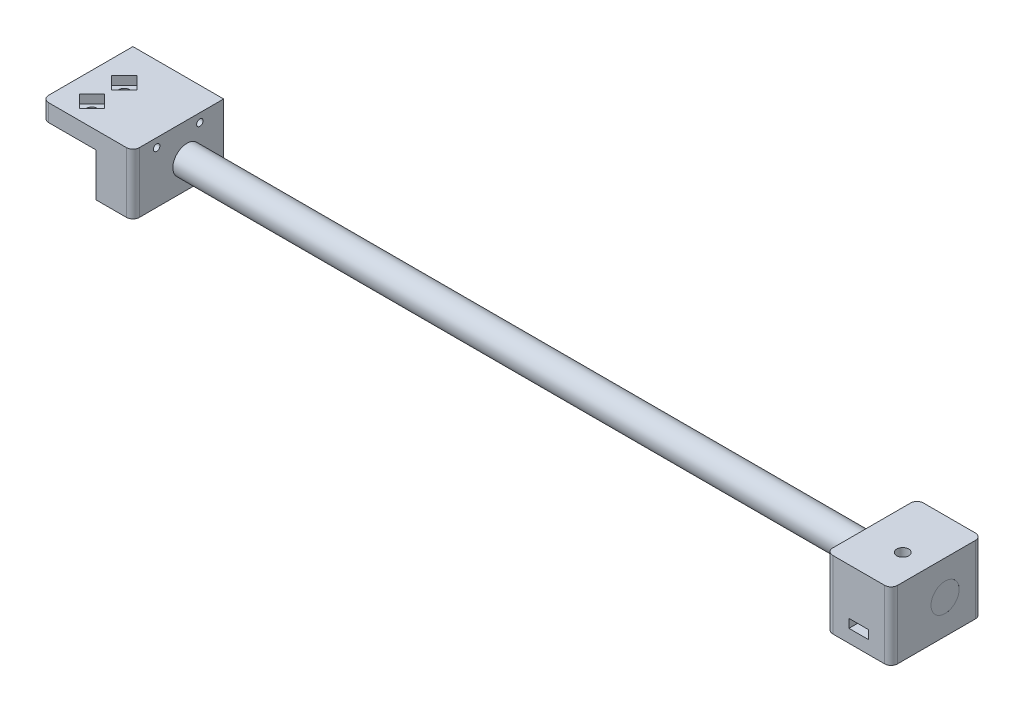
from build123d import *

# Parameters (mm, degrees)
SKETCH2_W                = 42
SKETCH2_H                = 42
BOSS_EXTRUDE1_DEPTH      = 22
SKETCH3_W                = 42
SKETCH3_H                = 42
BOSS_EXTRUDE2_DEPTH      = 6
BOSS_EXTRUDE3_START      = -25
SKETCH4_R                = 6.5
BOSS_EXTRUDE3_DEPTH      = 368
CUT_EXTRUDE6_START       = -25
SKETCH4_3_R              = 6.5
CUT_EXTRUDE6_DEPTH       = 17
SKETCH8_W                = 42
SKETCH8_H                = 28
SKETCH8_R                = 6.5
BOSS_EXTRUDE5_DEPTH      = 30
SKETCH11_W               = 25
SKETCH11_H               = 20
CUT_EXTRUDE9_DEPTH       = 50
SKETCH10_R               = 2.75
CUT_EXTRUDE8_DEPTH       = 12
FILLET2_R                = 3
FILLET1_R                = 3
SKETCH12_R               = 2.5
CUT_EXTRUDE10_DEPTH      = 20
CUT_EXTRUDE11_DEPTH      = 4
SKETCH14_R               = 2.5
CUT_EXTRUDE12_DEPTH      = 10
SKETCH15_R               = 1.5
CUT_EXTRUDE13_DEPTH      = 20
SKETCH16_R               = 2.5
BOSS_EXTRUDE6_DEPTH      = 3.5
CUT_EXTRUDE14_START      = -6
SKETCH18_W               = 9
SKETCH18_H               = 9
CUT_EXTRUDE14_DEPTH      = 4
SKETCH19_W               = 9
SKETCH19_H               = 9
CUT_EXTRUDE15_DEPTH      = 7
CUT_EXTRUDE16_DEPTH      = 7
CUT_EXTRUDE16_DEPTH_BACK = 4
SKETCH20_W               = 9
SKETCH20_H               = 9


with BuildPart() as part:
    # Sketch2 → Boss-Extrude1 (new body)
    with BuildSketch(Plane(origin=(0, 0, 0), x_dir=(1, 0, 0), z_dir=(0, 1, 0))):
        with Locations((21, -21)):
            Rectangle(SKETCH2_W, SKETCH2_H)
    extrude(amount=-BOSS_EXTRUDE1_DEPTH)

    # Sketch3 → Boss-Extrude2 (add)
    with BuildSketch(Plane(origin=(0, 0, 0), x_dir=(1, 0, 0), z_dir=(0, 1, 0))):
        with Locations((21, -21)):
            Rectangle(SKETCH3_W, SKETCH3_H)
    extrude(amount=BOSS_EXTRUDE2_DEPTH)

    # Sketch4<3> → Cut-Extrude6 (cut)
    with BuildSketch(Plane.ZY.offset(CUT_EXTRUDE6_START)):
        with Locations((17, -9.8)):
            Circle(SKETCH4_3_R)
    extrude(amount=-CUT_EXTRUDE6_DEPTH, mode=Mode.SUBTRACT)

    # Sketch11 → Cut-Extrude9 (cut)
    with BuildSketch(Plane.XY.offset(42)):
        with Locations((12.5, -12)):
            Rectangle(SKETCH11_W, SKETCH11_H)
    extrude(amount=-CUT_EXTRUDE9_DEPTH, mode=Mode.SUBTRACT)

    # Fillet1
    fillet1_edges = [part.edges().sort_by_distance(p)[0] for p in [
        (0, 2, 42),
        (42, -8, 42),
    ]]
    fillet(fillet1_edges, radius=FILLET1_R)

    # Sketch12 → Cut-Extrude10 (cut)
    with BuildSketch(Plane.XZ.offset(2)):
        with Locations(Location((12.5, 31.5, 0), (0, 0, 270))):
            Circle(SKETCH12_R)
        with Locations(Location((12.5, 16.5, 0), (0, 0, 270))):
            Circle(SKETCH12_R)
    extrude(amount=-CUT_EXTRUDE10_DEPTH, mode=Mode.SUBTRACT)

    # Sketch13 → Cut-Extrude11 (cut)
    with BuildSketch(Plane(origin=(0, 6, 0), x_dir=(1, 0, 0), z_dir=(0, 1, 0))):
        Polygon((6.701724394, -31.5), (12.5, -37.298275606), (18.298275606, -31.5), (12.5, -25.701724394), align=None)
        Polygon((6.701724394, -16.5), (12.5, -22.298275606), (18.298275606, -16.5), (12.5, -10.701724394), align=None)
    extrude(amount=-CUT_EXTRUDE11_DEPTH, mode=Mode.SUBTRACT)

    # Sketch15 → Cut-Extrude13 (cut)
    with BuildSketch(Plane(origin=(42, 0, 0), x_dir=(0, 0, -1), z_dir=(1, 0, 0))):
        with Locations((-31, 2)):
            Circle(SKETCH15_R)
        with Locations((-11, 2)):
            Circle(SKETCH15_R)
    extrude(amount=-CUT_EXTRUDE13_DEPTH, mode=Mode.SUBTRACT)


with BuildPart() as body_2:
    # Sketch4 → Boss-Extrude3 (new body)
    with BuildSketch(Plane.ZY.offset(BOSS_EXTRUDE3_START)):
        with Locations((17, -9.8)):
            Circle(SKETCH4_R)
    extrude(amount=-BOSS_EXTRUDE3_DEPTH)


with BuildPart() as body_3:
    # Sketch8 → Boss-Extrude5 (new body)
    with BuildSketch(Plane(origin=(393, 0, 0), x_dir=(0, 0, -1), z_dir=(1, 0, 0))):
        with Locations((-21, -8)):
            Rectangle(SKETCH8_W, SKETCH8_H)
        with Locations((-17, -9.8)):
            Circle(SKETCH8_R, mode=Mode.SUBTRACT)
    extrude(amount=-BOSS_EXTRUDE5_DEPTH)


with BuildPart() as cut_extrude8_tool:
    # Sketch10 → Cut-Extrude8 (new body)
    with BuildSketch(Plane(origin=(0, 6, 0), x_dir=(1, 0, 0), z_dir=(0, 1, 0))):
        with Locations(Location((381, -24.6, 0), (0, 0, 270))):
            Circle(SKETCH10_R)
    extrude(amount=-CUT_EXTRUDE8_DEPTH)


with BuildPart() as body_2_1:
    add(body_2.part)

    # Cut-Extrude8: cut by cut_extrude8_tool
    add(cut_extrude8_tool.part, mode=Mode.SUBTRACT)


with BuildPart() as body_3_1:
    add(body_3.part)

    # Cut-Extrude8: cut by cut_extrude8_tool
    add(cut_extrude8_tool.part, mode=Mode.SUBTRACT)

    # Fillet2
    fillet2_edges = [body_3_1.edges().sort_by_distance(p)[0] for p in [
        (363, -8, 42),
        (393, -8, 42),
        (393, -8, 0),
        (363, -8, 0),
    ]]
    fillet(fillet2_edges, radius=FILLET2_R)


with BuildPart() as cut_extrude12_tool:
    # Sketch14 → Cut-Extrude12 (new body)
    with BuildSketch(Plane.XZ.offset(22)):
        with Locations(Location((378, 34, 0), (0, 0, 270))):
            Circle(SKETCH14_R)
        with Locations(Location((378, 16, 0), (0, 0, 270))):
            Circle(SKETCH14_R)
    extrude(amount=-CUT_EXTRUDE12_DEPTH)


with BuildPart() as body_2_2:
    add(body_2_1.part)

    # Cut-Extrude12: cut by cut_extrude12_tool
    add(cut_extrude12_tool.part, mode=Mode.SUBTRACT)


with BuildPart() as body_3_2:
    add(body_3_1.part)

    # Cut-Extrude12: cut by cut_extrude12_tool
    add(cut_extrude12_tool.part, mode=Mode.SUBTRACT)

    # Sketch16 → Boss-Extrude6 (add)
    with BuildSketch(Plane.XZ.offset(22)):
        with BuildLine():
            Line((390, 42), (366, 42))
            ThreePointArc((366, 42), (363.878679656, 41.121320344), (363, 39))
            Line((363, 39), (363, 3))
            ThreePointArc((363, 3), (363.878679656, 0.878679656), (366, 0))
            Line((366, 0), (390, 0))
            ThreePointArc((390, 0), (392.121320344, 0.878679656), (393, 3))
            Line((393, 3), (393, 39))
            ThreePointArc((393, 39), (392.121320344, 41.121320344), (390, 42))
        make_face()
        with Locations(Location((378, 16, 0), (0, 0, 270))):
            Circle(SKETCH16_R, mode=Mode.SUBTRACT)
        with Locations(Location((378, 34, 0), (0, 0, 270))):
            Circle(SKETCH16_R, mode=Mode.SUBTRACT)
    extrude(amount=BOSS_EXTRUDE6_DEPTH)


with BuildPart() as cut_extrude14_tool:
    # Sketch18 → Cut-Extrude14 (new body)
    with BuildSketch(Plane.XZ.offset(25.5).offset(CUT_EXTRUDE14_START)):
        Polygon((373.5, 38.5), (373.5, 42), (382.5, 42), (382.5, 38.5), (382.5, 29.5), (373.5, 29.5), align=None)
        with Locations((378, 16)):
            Rectangle(SKETCH18_W, SKETCH18_H)
    extrude(amount=-CUT_EXTRUDE14_DEPTH)


with BuildPart() as body_2_3:
    add(body_2_2.part)

    # Cut-Extrude14: cut by cut_extrude14_tool
    add(cut_extrude14_tool.part, mode=Mode.SUBTRACT)


with BuildPart() as body_3_3:
    add(body_3_2.part)

    # Cut-Extrude14: cut by cut_extrude14_tool
    add(cut_extrude14_tool.part, mode=Mode.SUBTRACT)


with BuildPart() as cut_extrude15_tool:
    # Sketch19 → Cut-Extrude15 (new body)
    with BuildSketch(Plane.XZ.offset(15.5)):
        with Locations((378, 16)):
            Rectangle(SKETCH19_W, SKETCH19_H)
    extrude(amount=-CUT_EXTRUDE15_DEPTH)


with BuildPart() as body_2_4:
    add(body_2_3.part)

    # Cut-Extrude15: cut by cut_extrude15_tool
    add(cut_extrude15_tool.part, mode=Mode.SUBTRACT)


with BuildPart() as body_3_4:
    add(body_3_3.part)

    # Cut-Extrude15: cut by cut_extrude15_tool
    add(cut_extrude15_tool.part, mode=Mode.SUBTRACT)

    # Sketch20 → Cut-Extrude16 (cut, two sides: drawn at the far end of the back side and taken through both)
    with BuildSketch(Plane(origin=(0, -6, 0), x_dir=(1, 0, 0), z_dir=(0, 1, 0)).offset(-CUT_EXTRUDE16_DEPTH_BACK)):
        with Locations((381, -24.6)):
            Rectangle(SKETCH20_W, SKETCH20_H)
    extrude(amount=CUT_EXTRUDE16_DEPTH + CUT_EXTRUDE16_DEPTH_BACK, mode=Mode.SUBTRACT)


solid = Compound([part.part, body_2_4.part, body_3_4.part])
